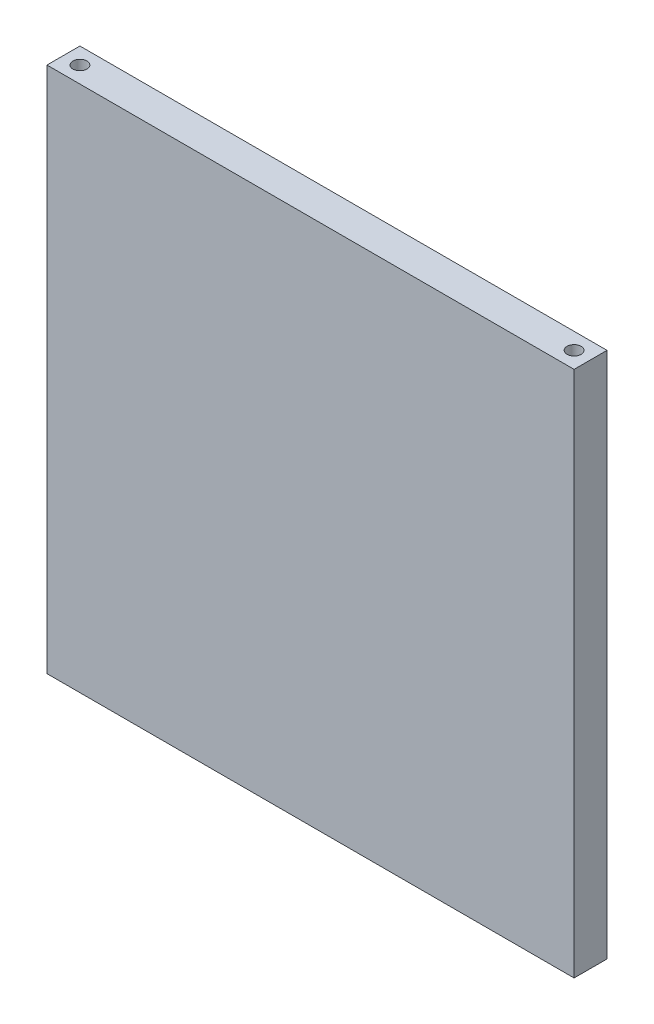
from build123d import *

# Parameters (mm, degrees)
SKETCH2_W                      = 101.6
SKETCH2_H                      = 101.6
BOSS_EXTRUDE1_DEPTH            = 6.35
F_6_32_TAPPED_HOLE1_AT_2_COUNT = 2
F_6_32_TAPPED_HOLE1_AT_2_PITCH = 95.25


with BuildPart() as part:
    # Sketch2 → Boss-Extrude1 (new body)
    with BuildSketch(Plane.XY):
        with Locations((50.8, 50.8)):
            Rectangle(SKETCH2_W, SKETCH2_H)
    extrude(amount=BOSS_EXTRUDE1_DEPTH)

    # Sketch7 → #6-32 Tapped Hole1 (revolve, cut)
    with BuildSketch(Plane(origin=(3.175, 101.6, 3.175), x_dir=(0, 0, 1), z_dir=(1, 0, 0))):
        Polygon((0, 0), (0, 10.21069403), (1.35255, 9.398), (1.35255, 0), align=None)
    f_6_32_tapped_hole1 = revolve(axis=Axis((3.175, 107.95, 3.175), (0, -1, 0)), mode=Mode.SUBTRACT)

    # #6-32 Tapped Hole1 at 2: #6-32 Tapped Hole1 ×2
    with Locations(*[(i * F_6_32_TAPPED_HOLE1_AT_2_PITCH, 0, 0) for i in range(1, F_6_32_TAPPED_HOLE1_AT_2_COUNT)]):
        add(f_6_32_tapped_hole1, mode=Mode.SUBTRACT)

    # Mirror1: #6-32 Tapped Hole1 across plane
    add(f_6_32_tapped_hole1.mirror(Plane.ZX.offset(50.8)), mode=Mode.SUBTRACT)

    # Mirror1 copy 1 sketch → Mirror1 copy 1 (revolve, cut)
    with BuildSketch(Plane(origin=(98.425, 0, 3.175), x_dir=(0, 0, 1), z_dir=(1, 0, 0))):
        Polygon((0, 0), (0, -10.21069403), (1.35255, -9.398), (1.35255, 0), align=None)
    revolve(axis=Axis((98.425, -6.35, 3.175), (0, -1, 0)), mode=Mode.SUBTRACT)


solid = part.part
